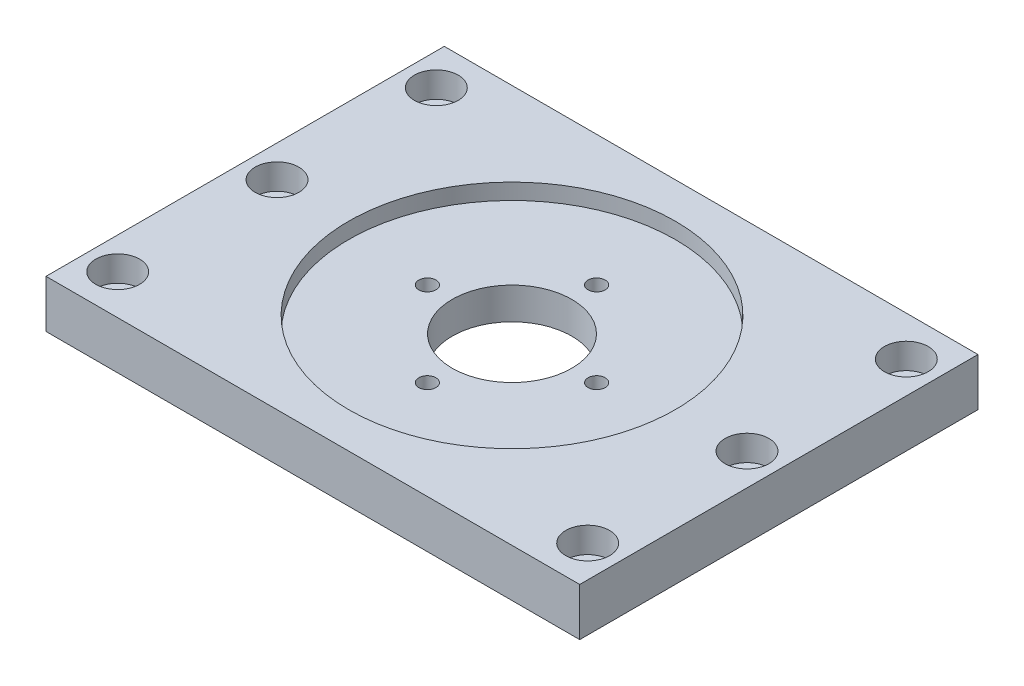
from build123d import *

# Parameters (mm, degrees)
SKETCH1_W                                           = 134
SKETCH1_H                                           = 100
BOSS_EXTRUDE1_DEPTH                                 = 12
SKETCH2_R                                           = 41
CUT_EXTRUDE1_DEPTH                                  = 4
SKETCH3_R                                           = 15
CUT_EXTRUDE2_DEPTH                                  = 84.982140959
M4_CLEARANCE_HOLE1_D                                = 4.3
M4_CLEARANCE_HOLE1_DEPTH                            = 15
M4_CLEARANCE_HOLE1_TIP                              = 1.291850331
CBORE_FOR_M6_HEX_SOCKET_HEAD_CAP_SCREW1_D           = 6.6
CBORE_FOR_M6_HEX_SOCKET_HEAD_CAP_SCREW1_DEPTH       = 15
CBORE_FOR_M6_HEX_SOCKET_HEAD_CAP_SCREW1_CBORE_D     = 11
CBORE_FOR_M6_HEX_SOCKET_HEAD_CAP_SCREW1_CBORE_DEPTH = 6.4
CBORE_FOR_M6_HEX_SOCKET_HEAD_CAP_SCREW1_TIP         = 1.982840043


with BuildPart() as part:
    # Sketch1 → Boss-Extrude1 (new body)
    with BuildSketch(Plane(origin=(0, 0, 0), x_dir=(1, 0, 0), z_dir=(0, 1, 0))):
        Rectangle(SKETCH1_W, SKETCH1_H)
    extrude(amount=BOSS_EXTRUDE1_DEPTH)

    # Sketch2 → Cut-Extrude1 (cut)
    with BuildSketch(Plane(origin=(0, 12, 0), x_dir=(1, 0, 0), z_dir=(0, 1, 0))):
        with Locations(Location((0, 0, 0), (0, 0, 270))):
            Circle(SKETCH2_R)
    extrude(amount=-CUT_EXTRUDE1_DEPTH, mode=Mode.SUBTRACT)

    # Sketch3 → Cut-Extrude2 (cut, through all)
    with BuildSketch(Plane(origin=(0, 8, 0), x_dir=(1, 0, 0), z_dir=(0, 1, 0))):
        with Locations(Location((0, 0, 0), (0, 0, 270))):
            Circle(SKETCH3_R)
    extrude(amount=-CUT_EXTRUDE2_DEPTH, mode=Mode.SUBTRACT)

    # M4 Clearance Hole1
    with Locations(Plane(origin=(0, 0, 0), x_dir=(-1, 0, 0), z_dir=(0, -1, 0))):
        with Locations((-21.25, 0), (0, 21.25), (21.25, 0), (0, -21.25)):
            Hole(M4_CLEARANCE_HOLE1_D / 2, depth=M4_CLEARANCE_HOLE1_DEPTH)
            with Locations((0, 0, -(M4_CLEARANCE_HOLE1_DEPTH + M4_CLEARANCE_HOLE1_TIP / 2))):  # 118° drill point
                Cone(0, M4_CLEARANCE_HOLE1_D / 2, M4_CLEARANCE_HOLE1_TIP, mode=Mode.SUBTRACT)

    # CBORE for M6 Hex Socket Head Cap Screw1
    with Locations(Plane(origin=(0, 12, 0), x_dir=(1, 0, 0), z_dir=(0, 1, 0))):
        with Locations((59, 40), (-59, 40), (-59, 0), (-59, -40), (59, 0), (59, -40)):
            CounterBoreHole(CBORE_FOR_M6_HEX_SOCKET_HEAD_CAP_SCREW1_D / 2, CBORE_FOR_M6_HEX_SOCKET_HEAD_CAP_SCREW1_CBORE_D / 2, CBORE_FOR_M6_HEX_SOCKET_HEAD_CAP_SCREW1_CBORE_DEPTH, depth=CBORE_FOR_M6_HEX_SOCKET_HEAD_CAP_SCREW1_DEPTH)
            with Locations((0, 0, -(CBORE_FOR_M6_HEX_SOCKET_HEAD_CAP_SCREW1_DEPTH + CBORE_FOR_M6_HEX_SOCKET_HEAD_CAP_SCREW1_TIP / 2))):  # 118° drill point
                Cone(0, CBORE_FOR_M6_HEX_SOCKET_HEAD_CAP_SCREW1_D / 2, CBORE_FOR_M6_HEX_SOCKET_HEAD_CAP_SCREW1_TIP, mode=Mode.SUBTRACT)


solid = part.part
